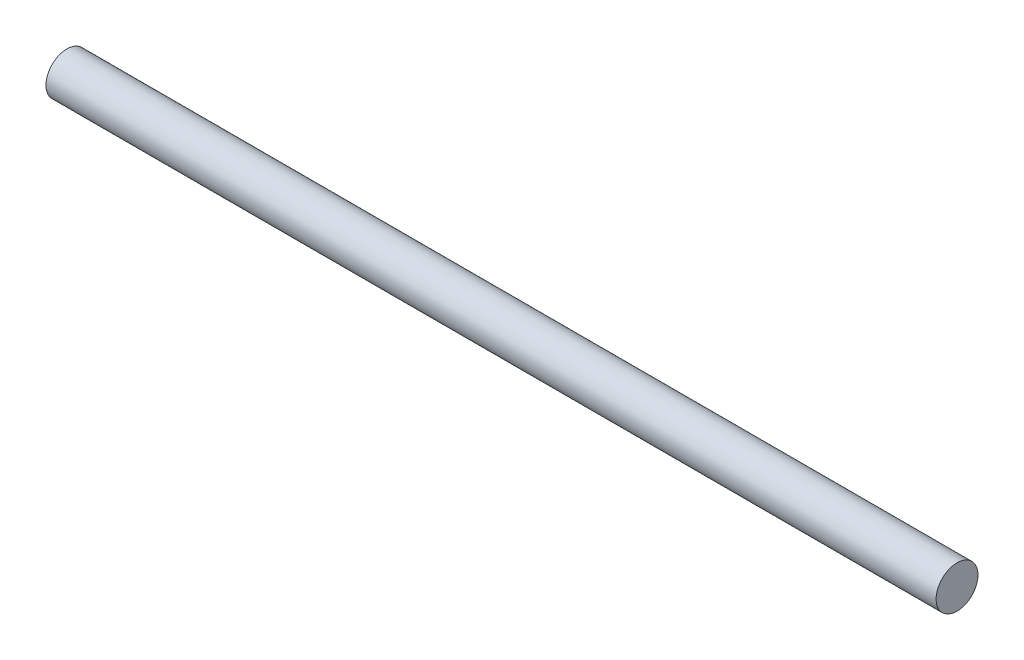
from build123d import *

# Parameters (mm, degrees)
ESQUISSE1_R        = 10.125
BOSS_EXTRU_1_DEPTH = 430


with BuildPart() as part:
    # Esquisse1 → Boss.-Extru.1 (new body)
    with BuildSketch(Plane(origin=(0, 0, 0), x_dir=(0, 0, -1), z_dir=(1, 0, 0))):
        Circle(ESQUISSE1_R)
    extrude(amount=BOSS_EXTRU_1_DEPTH)


solid = part.part
